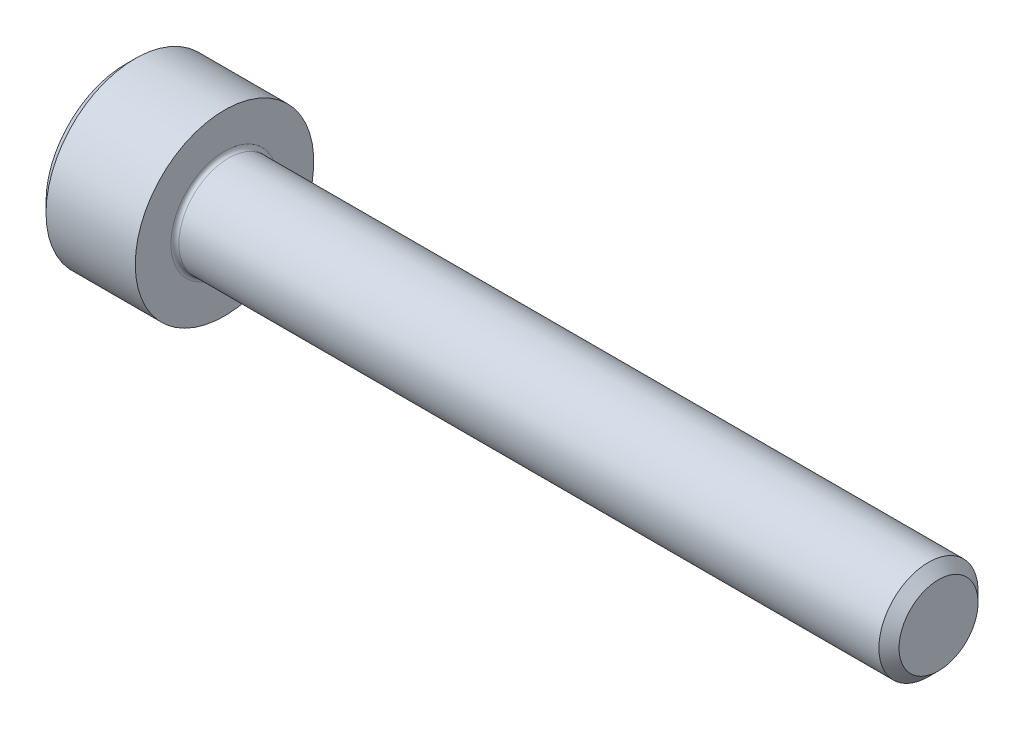
from build123d import *

# Parameters (mm, degrees)
FILLET1_R   = 0.1
HEX_2_DEPTH = 1.1


with BuildPart() as part:
    # BodySke → Base-Revolve (revolve)
    with BuildSketch(Plane.XY, mode=Mode.PRIVATE) as base_revolve_sk:
        Polygon((0, 0), (0, 2), (0.25, 2.25), (2.5, 2.25), (2.5, 1.25), (20.2465, 1.25), (20.5, 0.9965), (20.5, 0), align=None)
    revolve(base_revolve_sk.sketch.rotate(Axis((-31.75, 0, 0), (1, 0, 0)), 90), axis=Axis((-31.75, 0, 0), (1, 0, 0)))

    # Fillet1
    fillet1_edges = [part.edges().sort_by_distance(p)[0] for p in [
        (2.5, 0, -1.25),
    ]]
    fillet(fillet1_edges, radius=FILLET1_R)

    # Sketch2 → Hex-PreBroach (revolve, cut)
    with BuildSketch(Plane.XY, mode=Mode.PRIVATE) as hex_prebroach_sk:
        Polygon((0, 1.0225), (1.1, 1.0225), (1.69034065, 0), (0, 0), align=None)
    revolve(hex_prebroach_sk.sketch.rotate(Axis((0, 0, 0), (1, 0, 0)), 90), axis=Axis((0, 0, 0), (1, 0, 0)), mode=Mode.SUBTRACT)

    # Sketch3 → Hex 2 (cut)
    with BuildSketch(Plane(origin=(0, 0, 0), x_dir=(0, 0.500000000000001, 0.866025403784438), z_dir=(-1, 0, 0))):
        Polygon((0.59034065, 1.0225), (-0.59034065, 1.0225), (-1.1806813, 0), (-0.59034065, -1.0225), (0.59034065, -1.0225), (1.1806813, 0), align=None)
    extrude(amount=-HEX_2_DEPTH, mode=Mode.SUBTRACT)


solid = part.part
